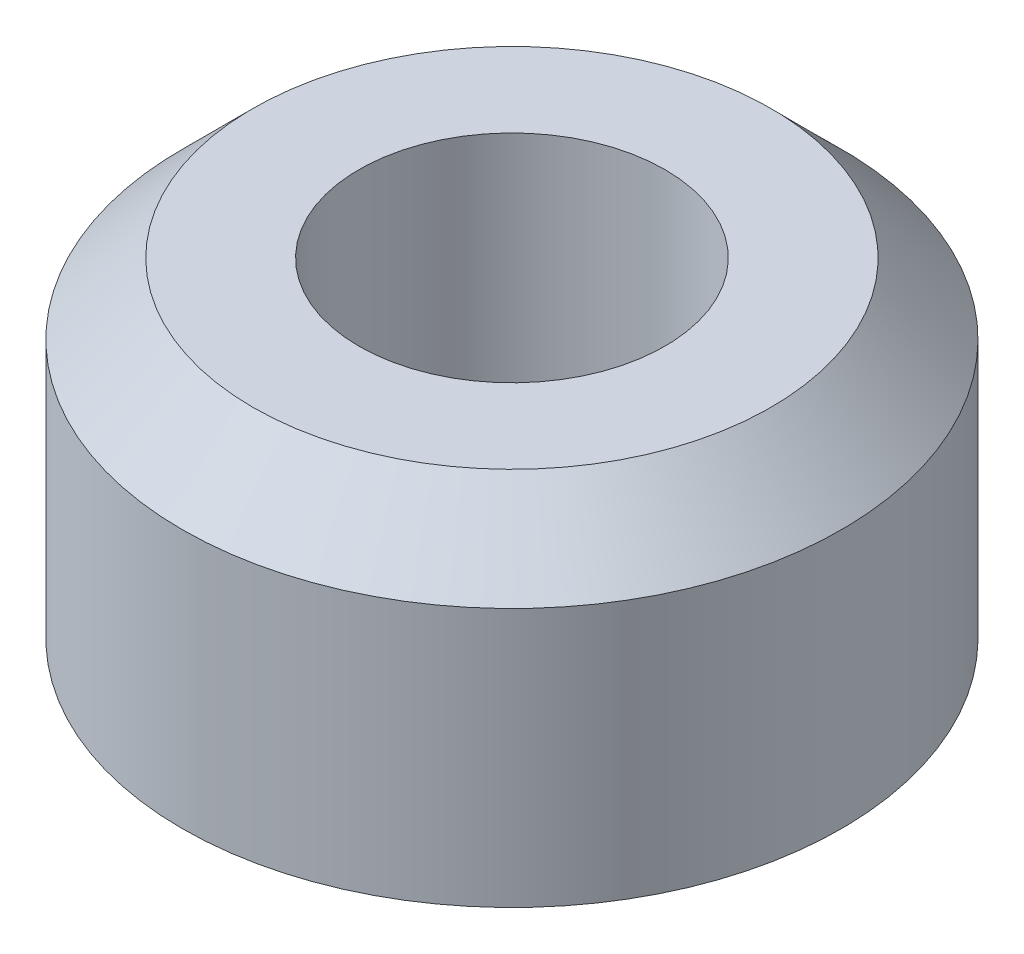
from build123d import *

# Parameters (mm, degrees)
SKETCH_1_R      = 7
SKETCH_1_R_2    = 3.25
EXTRUDE_1_DEPTH = 7
CHAMFER_1_SIZE  = 1.5


with BuildPart() as part:
    # 草图1 → 凸台-拉伸1 (new body)
    with BuildSketch(Plane(origin=(0, 0, 0), x_dir=(1, 0, 0), z_dir=(0, 1, 0))):
        with Locations(Location((0, 0, 0), (0, 0, 270))):
            Circle(SKETCH_1_R)
        with Locations(Location((0, 0, 0), (0, 0, 270))):
            Circle(SKETCH_1_R_2, mode=Mode.SUBTRACT)
    extrude(amount=EXTRUDE_1_DEPTH)

    # 倒角1
    chamfer_1_edges = [part.edges().sort_by_distance(p)[0] for p in [
        (0, 7, -7),
    ]]
    chamfer(chamfer_1_edges, length=CHAMFER_1_SIZE)


solid = part.part
